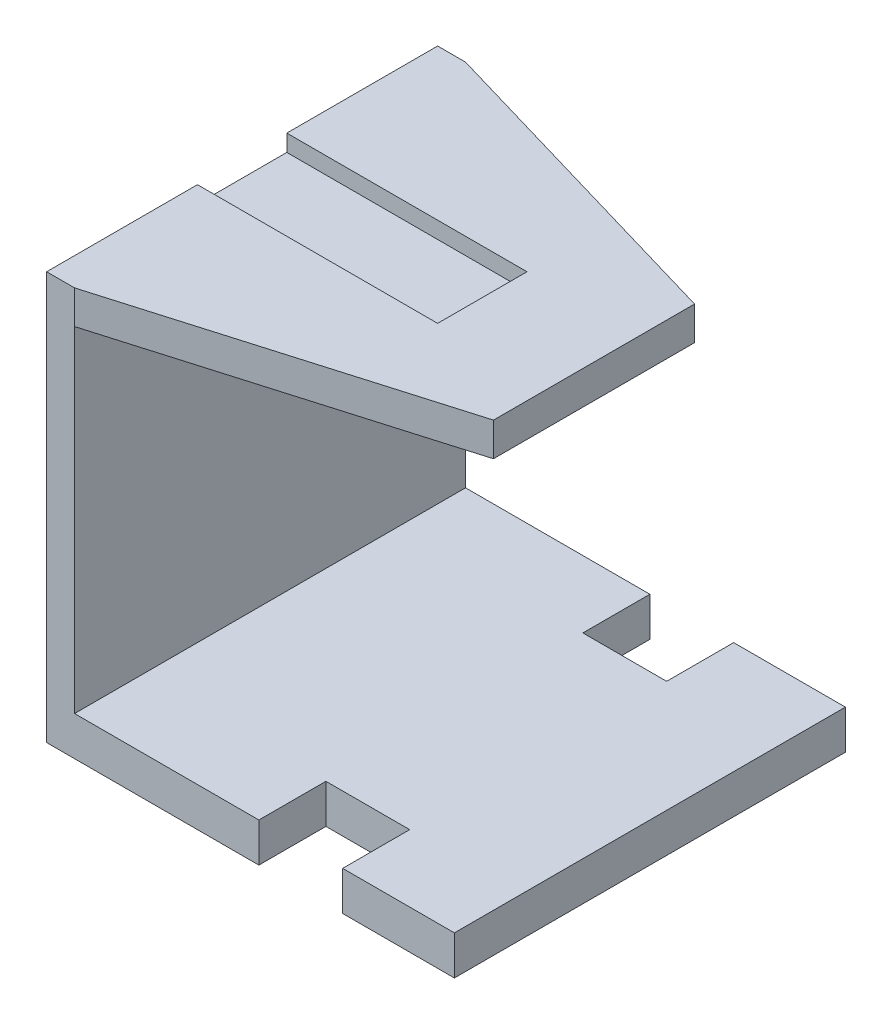
from build123d import *

# Parameters (mm, degrees)
SKETCH_1_W          = 7
SKETCH_1_H          = 60
SKETCH_1_W_2        = 75
SKETCH_1_H_2        = 7
EXTRUDE_1_DEPTH     = 35
EXTRUDE_2_DEPTH     = 6
SKETCH_3_W          = 45
SKETCH_3_H          = 8
CUT_EXTRUDE_1_DEPTH = 3
SKETCH_4_W          = 15
SKETCH_4_H          = 12
CUT_EXTRUDE_2_DEPTH = 106.858395983
CUT_EXTRUDE_3_DEPTH = 2


with BuildPart() as part:
    # Эскиз1 → Бобышка-Вытянуть1 (new body)
    with BuildSketch(Plane.XY):
        with Locations((3.5, 37)):
            Rectangle(SKETCH_1_W, SKETCH_1_H)
        with Locations((37.5, 3.5)):
            Rectangle(SKETCH_1_W_2, SKETCH_1_H_2)
    extrude_1 = extrude(amount=EXTRUDE_1_DEPTH)

    # Эскиз2 → Бобышка-Вытянуть2 (add)
    with BuildSketch(Plane(origin=(0, 67, 0), x_dir=(1, 0, 0), z_dir=(0, 1, 0))):
        Polygon((0, -35), (65, -35), (65, -17), (7, 0), (0, 0), align=None)
    extrude_2 = extrude(amount=EXTRUDE_2_DEPTH)

    # Эскиз3 → Вырез-Вытянуть1 (cut)
    with BuildSketch(Plane(origin=(0, 73, 0), x_dir=(1, 0, 0), z_dir=(0, 1, 0))):
        with Locations((22.5, -31)):
            Rectangle(SKETCH_3_W, SKETCH_3_H)
    cut_extrude_1 = extrude(amount=-CUT_EXTRUDE_1_DEPTH, mode=Mode.SUBTRACT)

    # Эскиз4 → Вырез-Вытянуть2 (cut, through all)
    with BuildSketch(Plane(origin=(0, 7, 0), x_dir=(1, 0, 0), z_dir=(0, 1, 0))):
        with Locations((47.5, -6)):
            Rectangle(SKETCH_4_W, SKETCH_4_H)
    cut_extrude_2 = extrude(amount=-CUT_EXTRUDE_2_DEPTH, mode=Mode.SUBTRACT)

    # Зеркальное отражение1: Бобышка-Вытянуть1, Бобышка-Вытянуть2, Вырез-Вытянуть1, Вырез-Вытянуть2 across plane
    add(extrude_1.mirror(Plane.XY.offset(35)))
    add(extrude_2.mirror(Plane.XY.offset(35)))
    add(cut_extrude_1.mirror(Plane.XY.offset(35)), mode=Mode.SUBTRACT)
    add(cut_extrude_2.mirror(Plane.XY.offset(35)), mode=Mode.SUBTRACT)

    # Эскиз5 → Вырез-Вытянуть3 (cut)
    with BuildSketch(Plane.ZY):
        Polygon((70, 73), (43, 73), (43, 70), (27, 70), (27, 73), (0, 73), (0, 0), (70, 0), align=None)
    extrude(amount=-CUT_EXTRUDE_3_DEPTH, mode=Mode.SUBTRACT)


solid = part.part
